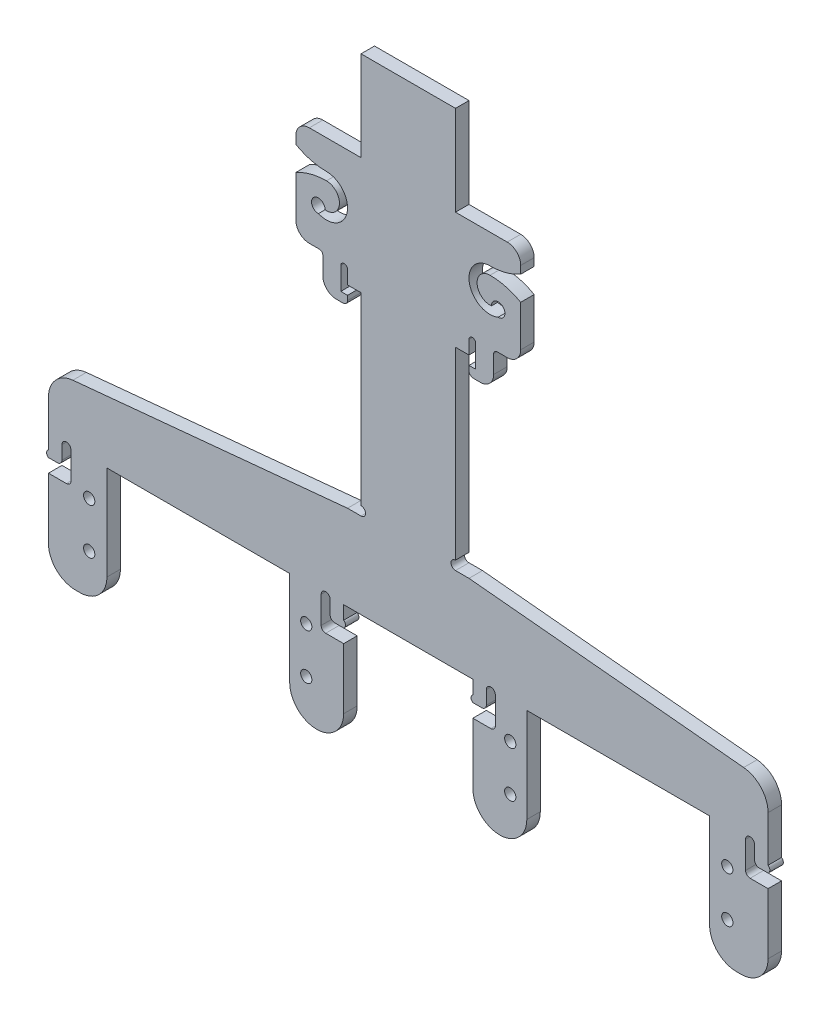
from build123d import *

# Parameters (mm, degrees)
BOSS_EXTRUDE1_DEPTH        = 3
SERVO_MOUNTING_HOLES_REACH = 190.982
SKETCH5_R                  = 1.25
ELASTIC_ANCHOR_REACH       = 190.982
TAB_RELIEF_CUT_SERVO_REACH = 190.982


with BuildPart() as part:
    # Sketch1 → Boss-Extrude1 (new body)
    with BuildSketch(Plane.XY):
        with BuildLine():
            Line((-67, 63), (-26.36, 63))
            Line((-26.36, 63), (-26.36, 42))
            ThreePointArc((-26.36, 42), (-20.36, 36), (-14.36, 42))
            Line((-14.36, 42), (-14.36, 58.5))
            ThreePointArc((-14.36, 58.5), (-13.96, 59.25), (-14.36, 60))
            Line((-14.36, 60), (-14.36, 63))
            Line((-14.36, 63), (0, 63))
            Line((0, 63), (14.36, 63))
            Line((14.36, 63), (14.36, 60))
            ThreePointArc((14.36, 60), (13.96, 59.25), (14.36, 58.5))
            Line((14.36, 58.5), (14.36, 42))
            ThreePointArc((14.36, 42), (20.36, 36), (26.36, 42))
            Line((26.36, 42), (26.36, 63))
            Line((26.36, 63), (67, 63))
            Line((67, 63), (67, 42))
            ThreePointArc((67, 42), (68.757359313, 37.757359313), (73, 36))
            Line((73, 36), (74, 36))
            ThreePointArc((74, 36), (78.242640687, 37.757359313), (80, 42))
            Line((80, 42), (80, 58.5))
            ThreePointArc((80, 58.5), (80.4, 59.25), (80, 60))
            Line((80, 60), (80, 63))
            Line((80, 63), (80, 70.141428429))
            ThreePointArc((80, 70.141428429), (78.441483291, 74.175437127), (74.575591273, 76.113755838))
            Line((74.575591273, 76.113755838), (13.5, 82))
            Line((13.5, 82), (10.5, 82))
            ThreePointArc((10.5, 82), (9.5, 83), (10.5, 84))
            Line((10.5, 84), (10.5, 125))
            Line((10.5, 125), (13.5, 125))
            Line((13.5, 125), (13.5, 128))
            ThreePointArc((13.5, 128), (14.25, 128.75), (15, 128))
            Line((15, 128), (15, 123))
            Line((15, 123), (13.5, 123))
            Line((13.5, 123), (13.5, 122))
            ThreePointArc((13.5, 122), (13.792893219, 121.292893219), (14.5, 121))
            Line((14.5, 121), (16, 121))
            ThreePointArc((16, 121), (18.121320344, 121.878679656), (19, 124))
            Line((19, 124), (19, 128))
            ThreePointArc((19, 128), (19.219669914, 128.530330086), (19.75, 128.75))
            Line((19.75, 128.75), (22, 128.75))
            ThreePointArc((22, 128.75), (24.121320344, 129.628679656), (25, 131.75))
            Line((25, 131.75), (25, 148))
            ThreePointArc((25, 148), (24.121320344, 150.121320344), (22, 151))
            Line((22, 151), (10.5, 151))
            Line((10.5, 151), (10.5, 171))
            Line((10.5, 171), (-10.5, 171))
            Line((-10.5, 171), (-10.5, 151))
            Line((-10.5, 151), (-22, 151))
            ThreePointArc((-22, 151), (-24.121320344, 150.121320344), (-25, 148))
            Line((-25, 148), (-25, 131.75))
            ThreePointArc((-25, 131.75), (-24.121320344, 129.628679656), (-22, 128.75))
            Line((-22, 128.75), (-19.75, 128.75))
            ThreePointArc((-19.75, 128.75), (-19.219669914, 128.530330086), (-19, 128))
            Line((-19, 128), (-19, 124))
            ThreePointArc((-19, 124), (-18.121320344, 121.878679656), (-16, 121))
            Line((-16, 121), (-14.5, 121))
            ThreePointArc((-14.5, 121), (-13.792893219, 121.292893219), (-13.5, 122))
            Line((-13.5, 122), (-13.5, 123))
            Line((-13.5, 123), (-15, 123))
            Line((-15, 123), (-15, 128))
            ThreePointArc((-15, 128), (-14.25, 128.75), (-13.5, 128))
            Line((-13.5, 128), (-13.5, 125))
            Line((-13.5, 125), (-10.5, 125))
            Line((-10.5, 125), (-10.5, 84))
            ThreePointArc((-10.5, 84), (-9.5, 83), (-10.5, 82))
            Line((-10.5, 82), (-13.5, 82))
            Line((-13.5, 82), (-74.575591273, 76.113755838))
            ThreePointArc((-74.575591273, 76.113755838), (-78.441483291, 74.175437127), (-80, 70.141428429))
            Line((-80, 70.141428429), (-80, 63))
            Line((-80, 63), (-80, 60))
            ThreePointArc((-80, 60), (-80.4, 59.25), (-80, 58.5))
            Line((-80, 58.5), (-80, 42))
            ThreePointArc((-80, 42), (-78.242640687, 37.757359313), (-74, 36))
            Line((-74, 36), (-73, 36))
            ThreePointArc((-73, 36), (-68.757359313, 37.757359313), (-67, 42))
            Line((-67, 42), (-67, 63))
        make_face()
    extrude(amount=BOSS_EXTRUDE1_DEPTH)

    # Sketch5 → servo mounting holes (cut, up to next)
    with BuildSketch(Plane.XY.offset(3), mode=Mode.PRIVATE) as servo_mounting_holes_sk1:
        with Locations((70.937, 55.174)):
            Circle(SKETCH5_R)
    servo_mounting_holes_tool1 = extrude(servo_mounting_holes_sk1.sketch, amount=-SERVO_MOUNTING_HOLES_REACH, mode=Mode.PRIVATE) & part.part
    # Sketch5 → servo mounting holes (cut, up to next)
    with BuildSketch(Plane.XY.offset(3), mode=Mode.PRIVATE) as servo_mounting_holes_sk2:
        with Locations((70.937, 45.014)):
            Circle(SKETCH5_R)
    servo_mounting_holes_tool2 = extrude(servo_mounting_holes_sk2.sketch, amount=-SERVO_MOUNTING_HOLES_REACH, mode=Mode.PRIVATE) & part.part
    # Sketch5 → servo mounting holes (cut, up to next)
    with BuildSketch(Plane.XY.offset(3), mode=Mode.PRIVATE) as servo_mounting_holes_sk3:
        with Locations(Location((-70.937, 55.174, 0), (0, 0, 180))):
            Circle(SKETCH5_R)
    servo_mounting_holes_tool3 = extrude(servo_mounting_holes_sk3.sketch, amount=-SERVO_MOUNTING_HOLES_REACH, mode=Mode.PRIVATE) & part.part
    # Sketch5 → servo mounting holes (cut, up to next)
    with BuildSketch(Plane.XY.offset(3), mode=Mode.PRIVATE) as servo_mounting_holes_sk4:
        with Locations(Location((-70.937, 45.014, 0), (0, 0, 180))):
            Circle(SKETCH5_R)
    servo_mounting_holes_tool4 = extrude(servo_mounting_holes_sk4.sketch, amount=-SERVO_MOUNTING_HOLES_REACH, mode=Mode.PRIVATE) & part.part
    # Sketch5 → servo mounting holes (cut, up to next)
    with BuildSketch(Plane.XY.offset(3), mode=Mode.PRIVATE) as servo_mounting_holes_sk5:
        with Locations((22.677, 55.174)):
            Circle(SKETCH5_R)
    servo_mounting_holes_tool5 = extrude(servo_mounting_holes_sk5.sketch, amount=-SERVO_MOUNTING_HOLES_REACH, mode=Mode.PRIVATE) & part.part
    # Sketch5 → servo mounting holes (cut, up to next)
    with BuildSketch(Plane.XY.offset(3), mode=Mode.PRIVATE) as servo_mounting_holes_sk6:
        with Locations((22.677, 45.014)):
            Circle(SKETCH5_R)
    servo_mounting_holes_tool6 = extrude(servo_mounting_holes_sk6.sketch, amount=-SERVO_MOUNTING_HOLES_REACH, mode=Mode.PRIVATE) & part.part
    # Sketch5 → servo mounting holes (cut, up to next)
    with BuildSketch(Plane.XY.offset(3), mode=Mode.PRIVATE) as servo_mounting_holes_sk7:
        with Locations(Location((-22.677, 55.174, 0), (0, 0, 180))):
            Circle(SKETCH5_R)
    servo_mounting_holes_tool7 = extrude(servo_mounting_holes_sk7.sketch, amount=-SERVO_MOUNTING_HOLES_REACH, mode=Mode.PRIVATE) & part.part
    # Sketch5 → servo mounting holes (cut, up to next)
    with BuildSketch(Plane.XY.offset(3), mode=Mode.PRIVATE) as servo_mounting_holes_sk8:
        with Locations(Location((-22.677, 45.014, 0), (0, 0, 180))):
            Circle(SKETCH5_R)
    servo_mounting_holes_tool8 = extrude(servo_mounting_holes_sk8.sketch, amount=-SERVO_MOUNTING_HOLES_REACH, mode=Mode.PRIVATE) & part.part
    add(servo_mounting_holes_tool1.solids().sort_by_distance((70.937, 55.174, 3))[0], mode=Mode.SUBTRACT)
    add(servo_mounting_holes_tool2.solids().sort_by_distance((70.937, 45.014, 3))[0], mode=Mode.SUBTRACT)
    add(servo_mounting_holes_tool3.solids().sort_by_distance((-70.937, 55.174, 3))[0], mode=Mode.SUBTRACT)
    add(servo_mounting_holes_tool4.solids().sort_by_distance((-70.937, 45.014, 3))[0], mode=Mode.SUBTRACT)
    add(servo_mounting_holes_tool5.solids().sort_by_distance((22.677, 55.174, 3))[0], mode=Mode.SUBTRACT)
    add(servo_mounting_holes_tool6.solids().sort_by_distance((22.677, 45.014, 3))[0], mode=Mode.SUBTRACT)
    add(servo_mounting_holes_tool7.solids().sort_by_distance((-22.677, 55.174, 3))[0], mode=Mode.SUBTRACT)
    add(servo_mounting_holes_tool8.solids().sort_by_distance((-22.677, 45.014, 3))[0], mode=Mode.SUBTRACT)

    # Sketch9 → elastic anchor (cut, up to next)
    with BuildSketch(Plane.XY.offset(3), mode=Mode.PRIVATE) as elastic_anchor_sk1:
        with BuildLine():
            ThreePointArc((19.96414143, 135.500428674), (21.060660172, 138.060660172), (18.500428674, 136.96414143))
            ThreePointArc((18.500428674, 136.96414143), (15.304532331, 139.662597854), (18.178026712, 142.702079807))
            ThreePointArc((18.178026712, 142.702079807), (21.986612172, 142.166705802), (25.5, 140.602079807))
            ThreePointArc((25.5, 140.602079807), (29.25852471, 137.13767164), (31.5, 132.543716867))
            Line((31.5, 132.543716867), (31.5, 154.660442747))
            ThreePointArc((31.5, 154.660442747), (29.25852471, 150.066487973), (25.5, 146.602079807))
            ThreePointArc((25.5, 146.602079807), (21.986612172, 145.037453812), (18.178026712, 144.502079807))
            ThreePointArc((18.178026712, 144.502079807), (13.589455886, 138.913585252), (19.96414143, 135.500428674))
        make_face()
    elastic_anchor_tool1 = extrude(elastic_anchor_sk1.sketch, amount=-ELASTIC_ANCHOR_REACH, mode=Mode.PRIVATE) & part.part
    # Sketch9 → elastic anchor (cut, up to next)
    with BuildSketch(Plane.XY.offset(3), mode=Mode.PRIVATE) as elastic_anchor_sk2:
        with BuildLine():
            ThreePointArc((-19.96414143, 135.500428674), (-21.060660172, 138.060660172), (-18.500428674, 136.96414143))
            ThreePointArc((-18.500428674, 136.96414143), (-15.304532331, 139.662597854), (-18.178026712, 142.702079807))
            ThreePointArc((-18.178026712, 142.702079807), (-21.986612172, 142.166705802), (-25.5, 140.602079807))
            ThreePointArc((-25.5, 140.602079807), (-29.25852471, 137.13767164), (-31.5, 132.543716867))
            Line((-31.5, 132.543716867), (-31.5, 154.660442747))
            ThreePointArc((-31.5, 154.660442747), (-29.25852471, 150.066487973), (-25.5, 146.602079807))
            ThreePointArc((-25.5, 146.602079807), (-21.986612172, 145.037453812), (-18.178026712, 144.502079807))
            ThreePointArc((-18.178026712, 144.502079807), (-13.589455886, 138.913585252), (-19.96414143, 135.500428674))
        make_face()
    elastic_anchor_tool2 = extrude(elastic_anchor_sk2.sketch, amount=-ELASTIC_ANCHOR_REACH, mode=Mode.PRIVATE) & part.part
    add(elastic_anchor_tool1.solids().sort_by_distance((24.986566, 142.492974, 3))[0], mode=Mode.SUBTRACT)
    add(elastic_anchor_tool2.solids().sort_by_distance((-24.986566, 142.492974, 3))[0], mode=Mode.SUBTRACT)

    # Sketch12 → tab relief cut servo (cut, up to next)
    with BuildSketch(Plane(origin=(0, 0, 0), x_dir=(-1, 0, 0), z_dir=(0, 0, -1)), mode=Mode.PRIVATE) as tab_relief_cut_servo_sk1:
        with BuildLine():
            Line((80, 58.5), (78, 58.5))
            ThreePointArc((78, 58.5), (77.292893219, 58.792893219), (77, 59.5))
            Line((77, 59.5), (77, 62.5))
            ThreePointArc((77, 62.5), (76, 63.5), (75, 62.5))
            Line((75, 62.5), (75, 56.5))
            ThreePointArc((75, 56.5), (75.292893219, 55.792893219), (76, 55.5))
            Line((76, 55.5), (80, 55.5))
            Line((80, 55.5), (80, 58.5))
        make_face()
    tab_relief_cut_servo_tool1 = extrude(tab_relief_cut_servo_sk1.sketch, amount=-TAB_RELIEF_CUT_SERVO_REACH, mode=Mode.PRIVATE) & part.part
    # Sketch12 → tab relief cut servo (cut, up to next)
    with BuildSketch(Plane(origin=(0, 0, 0), x_dir=(-1, 0, 0), z_dir=(0, 0, -1)), mode=Mode.PRIVATE) as tab_relief_cut_servo_sk2:
        with BuildLine():
            Line((17.36, 59.5), (17.36, 62.5))
            ThreePointArc((17.36, 62.5), (18.36, 63.5), (19.36, 62.5))
            Line((19.36, 62.5), (19.36, 56.5))
            ThreePointArc((19.36, 56.5), (19.067106781, 55.792893219), (18.36, 55.5))
            Line((18.36, 55.5), (14.36, 55.5))
            Line((14.36, 55.5), (14.36, 58.5))
            Line((14.36, 58.5), (16.36, 58.5))
            ThreePointArc((16.36, 58.5), (17.067106781, 58.792893219), (17.36, 59.5))
        make_face()
    tab_relief_cut_servo_tool2 = extrude(tab_relief_cut_servo_sk2.sketch, amount=-TAB_RELIEF_CUT_SERVO_REACH, mode=Mode.PRIVATE) & part.part
    # Sketch12 → tab relief cut servo (cut, up to next)
    with BuildSketch(Plane(origin=(0, 0, 0), x_dir=(-1, 0, 0), z_dir=(0, 0, -1)), mode=Mode.PRIVATE) as tab_relief_cut_servo_sk3:
        with BuildLine():
            Line((-77, 59.5), (-77, 62.5))
            ThreePointArc((-77, 62.5), (-76, 63.5), (-75, 62.5))
            Line((-75, 62.5), (-75, 56.5))
            ThreePointArc((-75, 56.5), (-75.292893219, 55.792893219), (-76, 55.5))
            Line((-76, 55.5), (-80, 55.5))
            Line((-80, 55.5), (-80, 58.5))
            Line((-80, 58.5), (-78, 58.5))
            ThreePointArc((-78, 58.5), (-77.292893219, 58.792893219), (-77, 59.5))
        make_face()
    tab_relief_cut_servo_tool3 = extrude(tab_relief_cut_servo_sk3.sketch, amount=-TAB_RELIEF_CUT_SERVO_REACH, mode=Mode.PRIVATE) & part.part
    # Sketch12 → tab relief cut servo (cut, up to next)
    with BuildSketch(Plane(origin=(0, 0, 0), x_dir=(-1, 0, 0), z_dir=(0, 0, -1)), mode=Mode.PRIVATE) as tab_relief_cut_servo_sk4:
        with BuildLine():
            Line((-17.36, 59.5), (-17.36, 62.5))
            ThreePointArc((-17.36, 62.5), (-18.36, 63.5), (-19.36, 62.5))
            Line((-19.36, 62.5), (-19.36, 56.5))
            ThreePointArc((-19.36, 56.5), (-19.067106781, 55.792893219), (-18.36, 55.5))
            Line((-18.36, 55.5), (-14.36, 55.5))
            Line((-14.36, 55.5), (-14.36, 58.5))
            Line((-14.36, 58.5), (-16.36, 58.5))
            ThreePointArc((-16.36, 58.5), (-17.067106781, 58.792893219), (-17.36, 59.5))
        make_face()
    tab_relief_cut_servo_tool4 = extrude(tab_relief_cut_servo_sk4.sketch, amount=-TAB_RELIEF_CUT_SERVO_REACH, mode=Mode.PRIVATE) & part.part
    add(tab_relief_cut_servo_tool1.solids().sort_by_distance((-76.933189, 58.54451, 0))[0], mode=Mode.SUBTRACT)
    add(tab_relief_cut_servo_tool2.solids().sort_by_distance((-17.426811, 58.54451, 0))[0], mode=Mode.SUBTRACT)
    add(tab_relief_cut_servo_tool3.solids().sort_by_distance((76.933189, 58.54451, 0))[0], mode=Mode.SUBTRACT)
    add(tab_relief_cut_servo_tool4.solids().sort_by_distance((17.426811, 58.54451, 0))[0], mode=Mode.SUBTRACT)


solid = part.part
